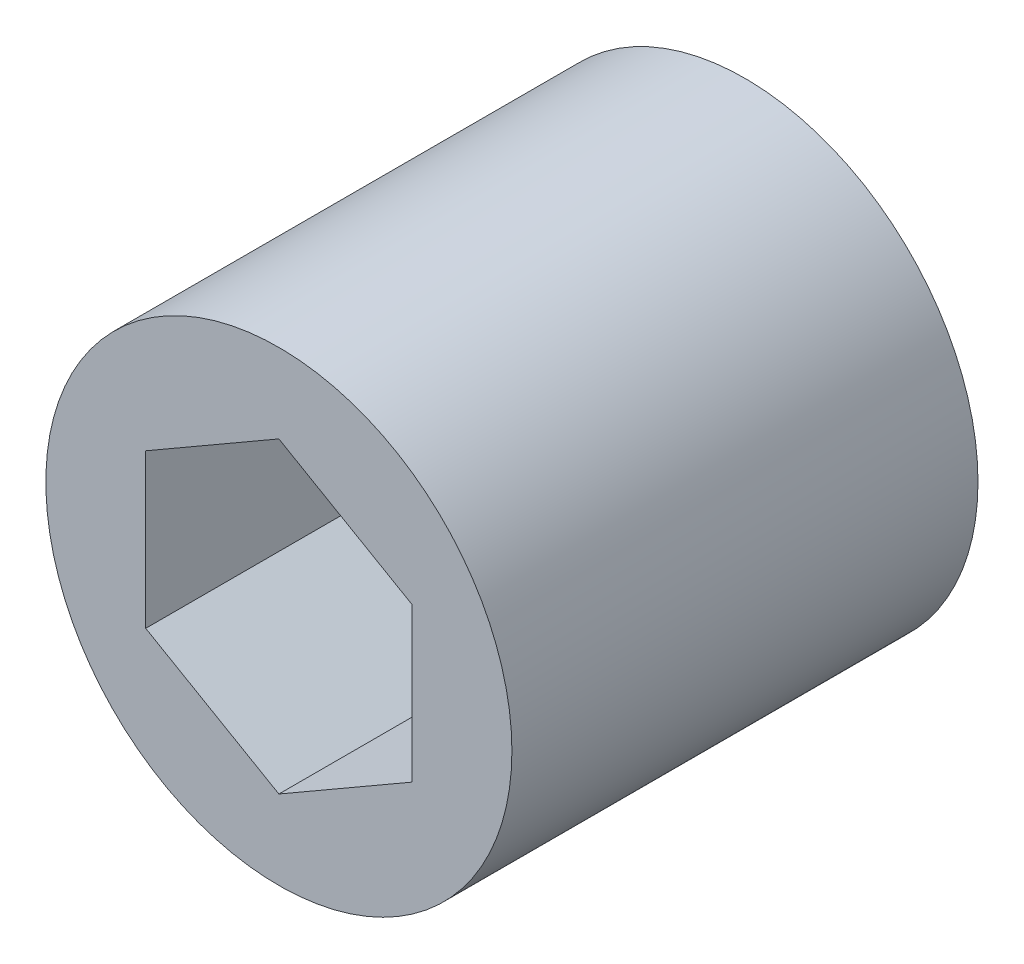
from build123d import *

# Parameters (mm, degrees)
SKETCH1_R           = 11.1125
BOSS_EXTRUDE1_DEPTH = 22.225


with BuildPart() as part:
    # Sketch1 → Boss-Extrude1 (new body)
    with BuildSketch(Plane.XY):
        Circle(SKETCH1_R)
        Polygon((0, 7.332348419), (-6.35, 3.666174209), (-6.35, -3.666174209), (0, -7.332348419), (6.35, -3.666174209), (6.35, 3.666174209), align=None, mode=Mode.SUBTRACT)
    extrude(amount=BOSS_EXTRUDE1_DEPTH)


solid = part.part
